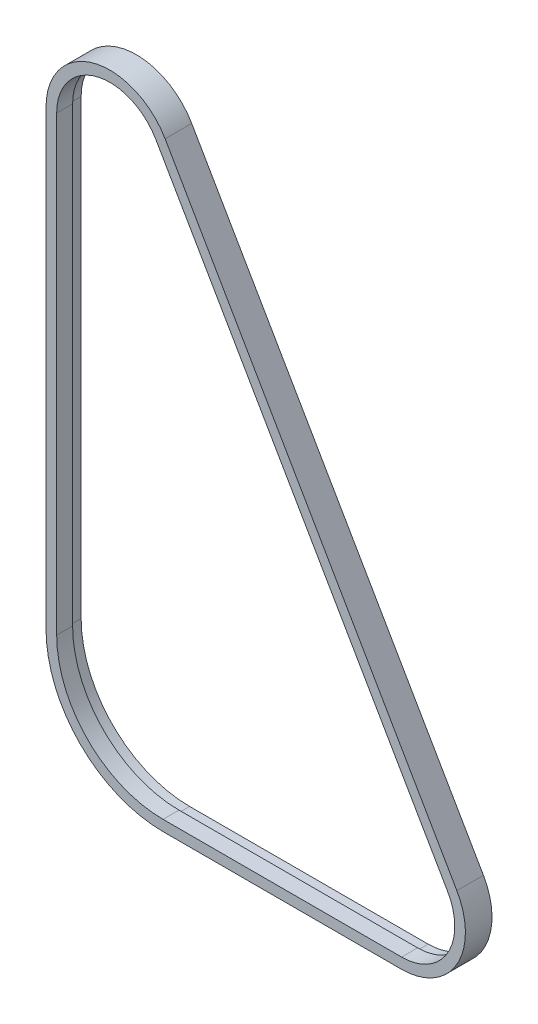
from build123d import *

# Parameters (mm, degrees)
BOSS_EXTRUDE1_DEPTH = 25
CUT_EXTRUDE2_DEPTH  = 10


with BuildPart() as part:
    # Sketch1 → Boss-Extrude1 (new body)
    with BuildSketch(Plane.XY):
        with BuildLine():
            Line((1.961524227, 555), (276.202902092, 80))
            ThreePointArc((276.202902092, 80), (276.202902092, 20), (224.241377865, -10))
            Line((224.241377865, -10), (0, -10))
            ThreePointArc((0, -10), (-77.781745931, 22.218254069), (-110, 100))
            Line((-110, 100), (-110, 525))
            ThreePointArc((-110, 525), (-65.529142706, 582.955549577), (1.961524227, 555))
        make_face()
        with BuildLine():
            Line((-100, 100), (-100, 525))
            ThreePointArc((-100, 525), (-62.940952255, 573.296291314), (-6.698729811, 550))
            Line((-6.698729811, 550), (267.542648054, 75))
            ThreePointArc((267.542648054, 75), (267.542648054, 25), (224.241377865, 0))
            Line((224.241377865, 0), (0, 0))
            ThreePointArc((0, 0), (-70.710678119, 29.289321881), (-100, 100))
        make_face(mode=Mode.SUBTRACT)
    extrude(amount=BOSS_EXTRUDE1_DEPTH)

    # Sketch3 → Cut-Extrude2 (cut)
    with BuildSketch(Plane.XY):
        with BuildLine():
            Line((269.274698862, 76), (-4.966679003, 551))
            ThreePointArc((-4.966679003, 551), (-63.458590345, 575.228142967), (-102, 525))
            Line((-102, 525), (-102, 100))
            ThreePointArc((-102, 100), (-72.124891681, 27.875108319), (0, -2))
            Line((0, -2), (224.241377865, -2))
            ThreePointArc((224.241377865, -2), (269.274698862, 24), (269.274698862, 76))
        make_face()
    extrude(amount=CUT_EXTRUDE2_DEPTH, mode=Mode.SUBTRACT)


solid = part.part
